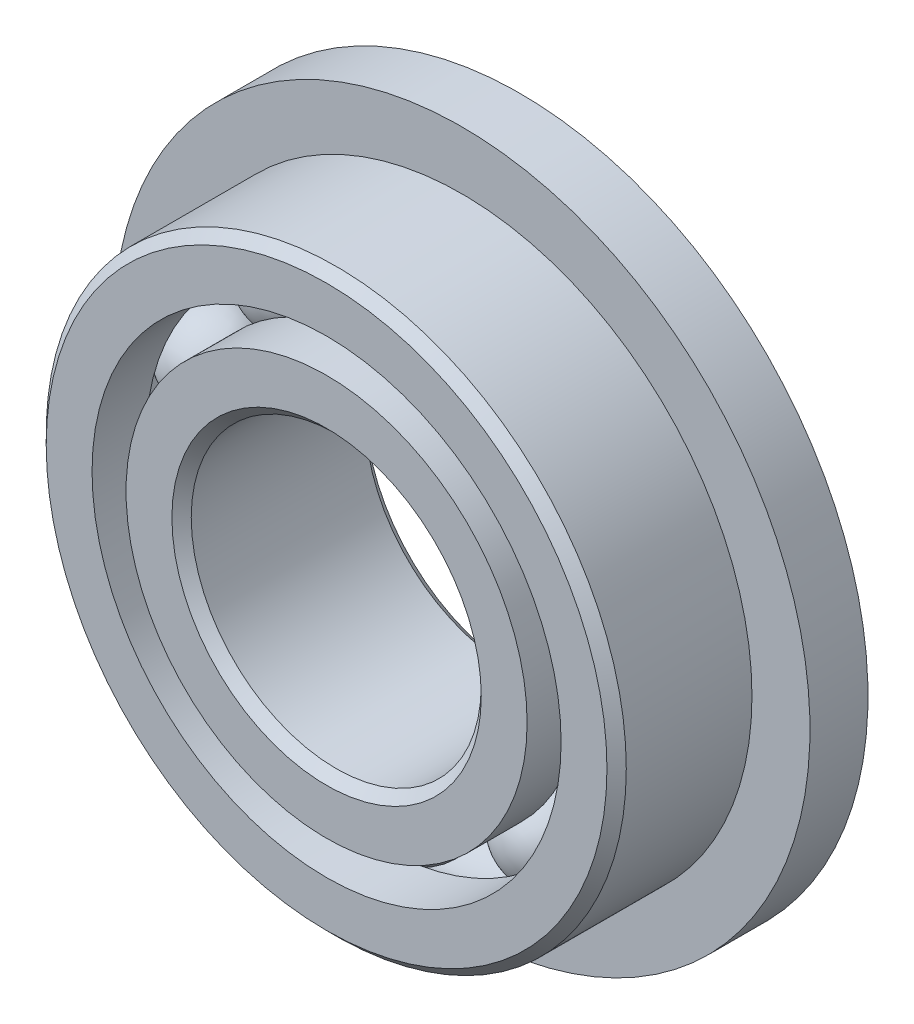
from build123d import *

# Parameters (mm, degrees)
CIRPATTERN1_COUNT = 10
SKETCH6_W         = 0.6
SKETCH6_H         = 1.174175824


with BuildPart() as part:
    # Sketch1 → Revolve1 (revolve)
    with BuildSketch(Plane(origin=(0, 0, 0), x_dir=(0, 0, -1), z_dir=(1, 0, 0))):
        with BuildLine():
            Line((0.9, 3), (-0.9, 3))
            Line((-0.9, 3), (-1, 2.9))
            Line((-1, 2.9), (-1, 2.425824176))
            Line((-1, 2.425824176), (-0.444444444, 2.425824176))
            ThreePointArc((-0.444444444, 2.425824176), (0, 2.727959209), (0.444444444, 2.425824176))
            Line((0.444444444, 2.425824176), (1, 2.425824176))
            Line((1, 2.425824176), (1, 2.9))
            Line((1, 2.9), (0.9, 3))
        make_face()
    revolve(axis=Axis((0, 0, 1), (0, 0, -1)))

    # Sketch6 → Revolve6 (revolve)
    with BuildSketch(Plane(origin=(0, 0, 0), x_dir=(0, 0, -1), z_dir=(1, 0, 0))):
        with Locations((0.7, 3.012912088)):
            Rectangle(SKETCH6_W, SKETCH6_H)
    revolve(axis=Axis((0, 0, -1), (0, 0, 1)))


with BuildPart() as body_2:
    # Sketch3 → Revolve3 (revolve)
    with BuildSketch(Plane(origin=(0, 0, 0), x_dir=(0, 0, -1), z_dir=(1, 0, 0))):
        with BuildLine():
            Line((-1, 2.074175824), (-0.444444444, 2.074175824))
            ThreePointArc((-0.444444444, 2.074175824), (0, 1.772040791), (0.444444444, 2.074175824))
            Line((0.444444444, 2.074175824), (1, 2.074175824))
            Line((1, 2.074175824), (1, 1.6))
            Line((1, 1.6), (0.9, 1.5))
            Line((0.9, 1.5), (-0.9, 1.5))
            Line((-0.9, 1.5), (-1, 1.6))
            Line((-1, 1.6), (-1, 2.074175824))
        make_face()
    revolve(axis=Axis((0, 0, 1), (0, 0, -1)))


with BuildPart() as body_3:
    # Sketch4 → Revolve4 (revolve)
    with BuildSketch(Plane(origin=(0, 0, 0), x_dir=(0, 0, -1), z_dir=(1, 0, 0))):
        with BuildLine():
            Line((-0.477959209, 2.25), (0.477959209, 2.25))
            ThreePointArc((0.477959209, 2.25), (0, 2.727959209), (-0.477959209, 2.25))
        make_face()
    revolve(axis=Axis((0, 2.25, 0.477959209), (0, 0, -1)))


with BuildPart() as cirpattern1_1:
    # CirPattern1: pattern copy
    add(body_3.part.rotate(Axis((0, 0, -1), (0, 0, 1)), 1 * 360 / CIRPATTERN1_COUNT))


with BuildPart() as cirpattern1_2:
    # CirPattern1: pattern copy
    add(body_3.part.rotate(Axis((0, 0, -1), (0, 0, 1)), 2 * 360 / CIRPATTERN1_COUNT))


with BuildPart() as cirpattern1_3:
    # CirPattern1: pattern copy
    add(body_3.part.rotate(Axis((0, 0, -1), (0, 0, 1)), 3 * 360 / CIRPATTERN1_COUNT))


with BuildPart() as cirpattern1_4:
    # CirPattern1: pattern copy
    add(body_3.part.rotate(Axis((0, 0, -1), (0, 0, 1)), 4 * 360 / CIRPATTERN1_COUNT))


with BuildPart() as cirpattern1_5:
    # CirPattern1: pattern copy
    add(body_3.part.rotate(Axis((0, 0, -1), (0, 0, 1)), 5 * 360 / CIRPATTERN1_COUNT))


with BuildPart() as cirpattern1_6:
    # CirPattern1: pattern copy
    add(body_3.part.rotate(Axis((0, 0, -1), (0, 0, 1)), 6 * 360 / CIRPATTERN1_COUNT))


with BuildPart() as cirpattern1_7:
    # CirPattern1: pattern copy
    add(body_3.part.rotate(Axis((0, 0, -1), (0, 0, 1)), 7 * 360 / CIRPATTERN1_COUNT))


with BuildPart() as cirpattern1_8:
    # CirPattern1: pattern copy
    add(body_3.part.rotate(Axis((0, 0, -1), (0, 0, 1)), 8 * 360 / CIRPATTERN1_COUNT))


with BuildPart() as cirpattern1_9:
    # CirPattern1: pattern copy
    add(body_3.part.rotate(Axis((0, 0, -1), (0, 0, 1)), 9 * 360 / CIRPATTERN1_COUNT))


solid = Compound([part.part, body_2.part, body_3.part, cirpattern1_1.part, cirpattern1_2.part, cirpattern1_3.part, cirpattern1_4.part, cirpattern1_5.part, cirpattern1_6.part, cirpattern1_7.part, cirpattern1_8.part, cirpattern1_9.part])
